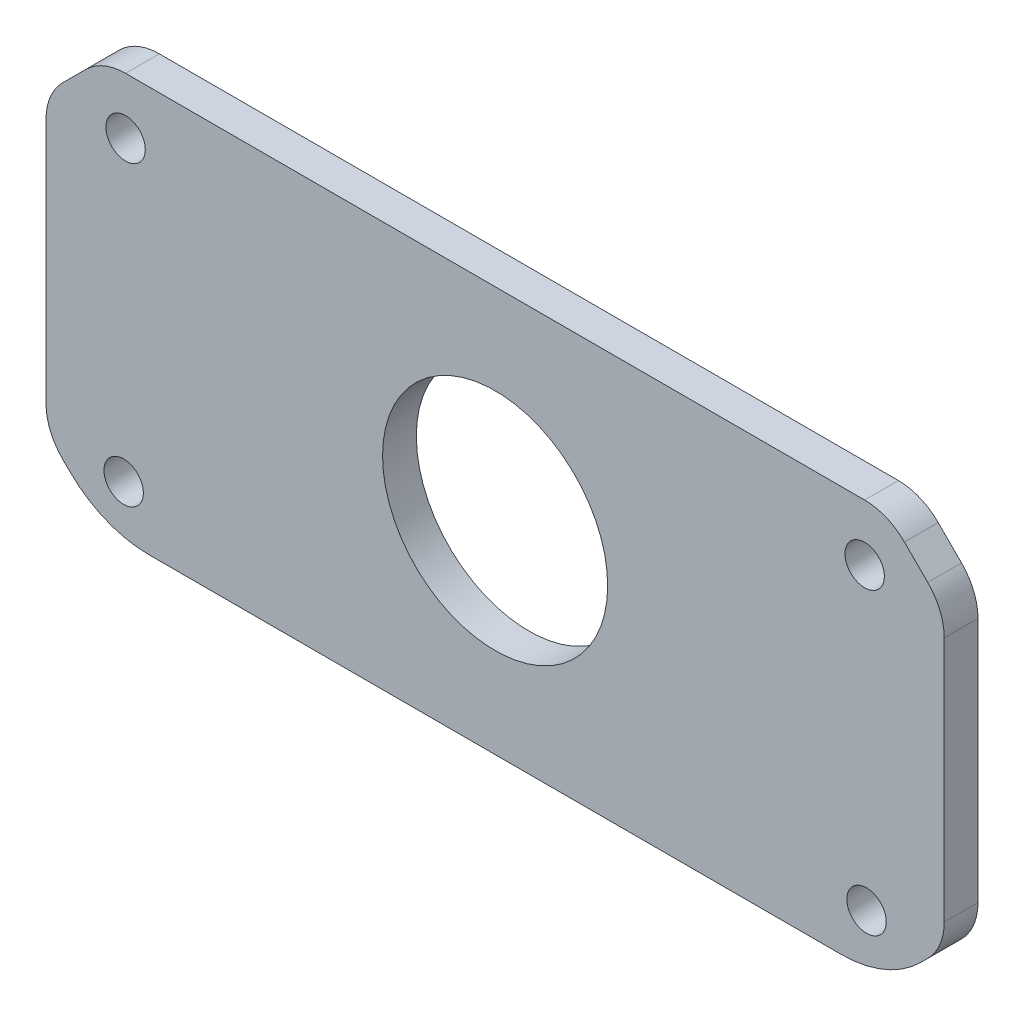
from build123d import *

# Parameters (mm, degrees)
SKETCH1_R           = 1.75
SKETCH1_R_2         = 10
BOSS_EXTRUDE1_DEPTH = 3
FILLET1_R           = 10


with BuildPart() as part:
    # Sketch1 → Boss-Extrude1 (new body)
    with BuildSketch(Plane.XY):
        with BuildLine():
            Line((-39.9, -10.928932188), (-39.9, 10.928932188))
            ThreePointArc((-39.9, 10.928932188), (-39.519397663, 12.84234935), (-38.435533906, 14.464466094))
            Line((-38.435533906, 14.464466094), (-36.364466094, 16.535533906))
            ThreePointArc((-36.364466094, 16.535533906), (-34.74234935, 17.619397663), (-32.828932188, 18))
            Line((-32.828932188, 18), (32.828932188, 18))
            ThreePointArc((32.828932188, 18), (34.74234935, 17.619397663), (36.364466094, 16.535533906))
            Line((36.364466094, 16.535533906), (38.435533906, 14.464466094))
            ThreePointArc((38.435533906, 14.464466094), (39.519397663, 12.84234935), (39.9, 10.928932188))
            Line((39.9, 10.928932188), (39.9, -10.928932188))
            ThreePointArc((39.9, -10.928932188), (39.519397663, -12.84234935), (38.435533906, -14.464466094))
            Line((38.435533906, -14.464466094), (34.9, -18))
            Line((34.9, -18), (8.1, -18))
            Line((8.1, -18), (-8.1, -18))
            Line((-8.1, -18), (-34.9, -18))
            Line((-34.9, -18), (-38.435533906, -14.464466094))
            ThreePointArc((-38.435533906, -14.464466094), (-39.519397663, -12.84234935), (-39.9, -10.928932188))
        make_face()
        with Locations((-32.828932188, 13)):
            Circle(SKETCH1_R, mode=Mode.SUBTRACT)
        with Locations((-33, -13.5)):
            Circle(SKETCH1_R, mode=Mode.SUBTRACT)
        with Locations(Location((33, -13.5, 0), (0, 0, 180))):
            Circle(SKETCH1_R, mode=Mode.SUBTRACT)
        with Locations(Location((32.828932188, 13, 0), (0, 0, 180))):
            Circle(SKETCH1_R, mode=Mode.SUBTRACT)
        Circle(SKETCH1_R_2, mode=Mode.SUBTRACT)
    extrude(amount=BOSS_EXTRUDE1_DEPTH)

    # Fillet1
    fillet1_edges = [part.edges().sort_by_distance(p)[0] for p in [
        (34.9, -18, 1.5),
        (-34.9, -18, 1.5),
    ]]
    fillet(fillet1_edges, radius=FILLET1_R)


solid = part.part
